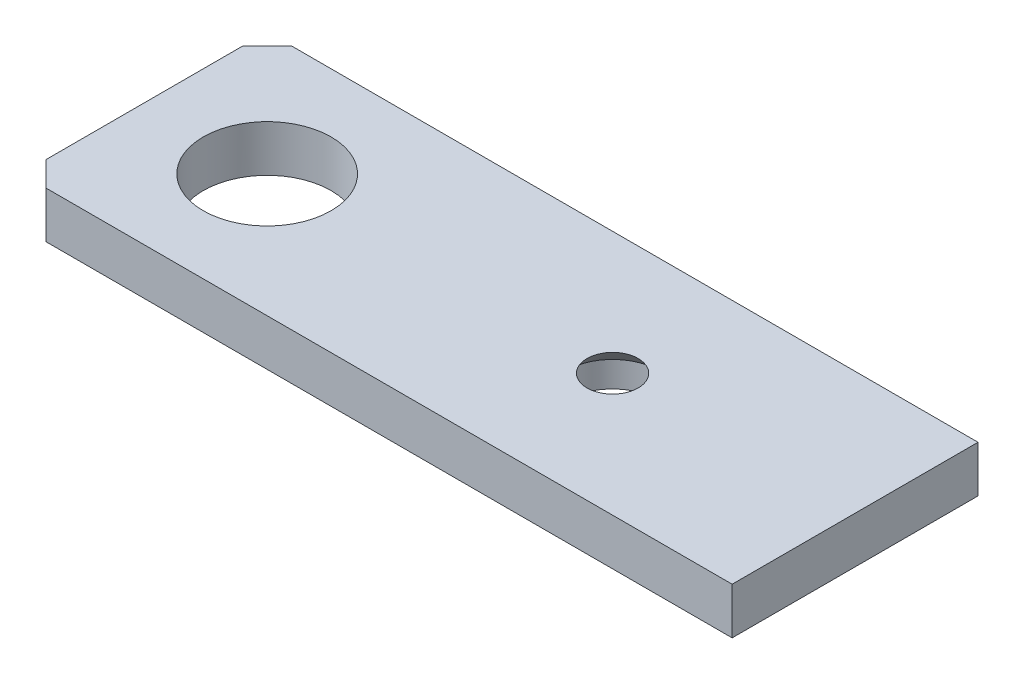
from build123d import *

# Parameters (mm, degrees)
SKETCH1_W           = 42.3
SKETCH1_H           = 42.3
SKETCH1_R           = 11
BOSS_EXTRUDE1_DEPTH = 2
SKETCH2_W           = 80
SKETCH2_H           = 42.3
SKETCH2_R           = 8
BOSS_EXTRUDE2_DEPTH = 2
SKETCH3_W           = 122.3
SKETCH3_H           = 42.3
SKETCH3_R           = 8
SKETCH3_R_2         = 11
BOSS_EXTRUDE3_DEPTH = 6
CUT_EXTRUDE1_DEPTH  = 8


with BuildPart() as part:
    # Sketch1 → Boss-Extrude1 (new body)
    with BuildSketch(Plane(origin=(0, 0, 0), x_dir=(1, 0, 0), z_dir=(0, 1, 0))):
        Rectangle(SKETCH1_W, SKETCH1_H)
        with Locations(Location((0, 0, 0), (0, 0, 270))):
            Circle(SKETCH1_R, mode=Mode.SUBTRACT)
    extrude(amount=BOSS_EXTRUDE1_DEPTH)

    # Sketch2 → Boss-Extrude2 (add)
    with BuildSketch(Plane(origin=(0, 2, 0), x_dir=(1, 0, 0), z_dir=(0, 1, 0))):
        with Locations((61.15, 0)):
            Rectangle(SKETCH2_W, SKETCH2_H)
        with Locations(Location((59.43, 0, 0), (0, 0, 270))):
            Circle(SKETCH2_R, mode=Mode.SUBTRACT)
    extrude(amount=-BOSS_EXTRUDE2_DEPTH)

    # Sketch3 → Boss-Extrude3 (add)
    with BuildSketch(Plane.XZ):
        with Locations((40, 0)):
            Rectangle(SKETCH3_W, SKETCH3_H)
        with Locations(Location((59.43, 0, 0), (0, 0, 90))):
            Circle(SKETCH3_R, mode=Mode.SUBTRACT)
        with Locations(Location((0, 0, 0), (0, 0, 270))):
            Circle(SKETCH3_R_2, mode=Mode.SUBTRACT)
    extrude(amount=BOSS_EXTRUDE3_DEPTH)

    # Sketch5 → Revolve1 (revolve)
    with BuildSketch(Plane.XY, mode=Mode.PRIVATE) as revolve1_sk:
        Polygon((67.43, 2), (63.83, 2), (67.43, -1.6), align=None)
    revolve(revolve1_sk.sketch.rotate(Axis((59.43, 0, 0), (0, 1, 0)), 90), axis=Axis((59.43, 0, 0), (0, 1, 0)))

    # Sketch6 → Cut-Extrude1 (cut)
    with BuildSketch(Plane(origin=(0, 2, 0), x_dir=(1, 0, 0), z_dir=(0, 1, 0))):
        Polygon((-21.15, 16.907359313), (-16.907359313, 21.15), (-21.15, 21.15), align=None)
        Polygon((-21.15, -21.15), (-21.15, -16.907359313), (-16.907359313, -21.15), align=None)
    extrude(amount=-CUT_EXTRUDE1_DEPTH, mode=Mode.SUBTRACT)


solid = part.part
